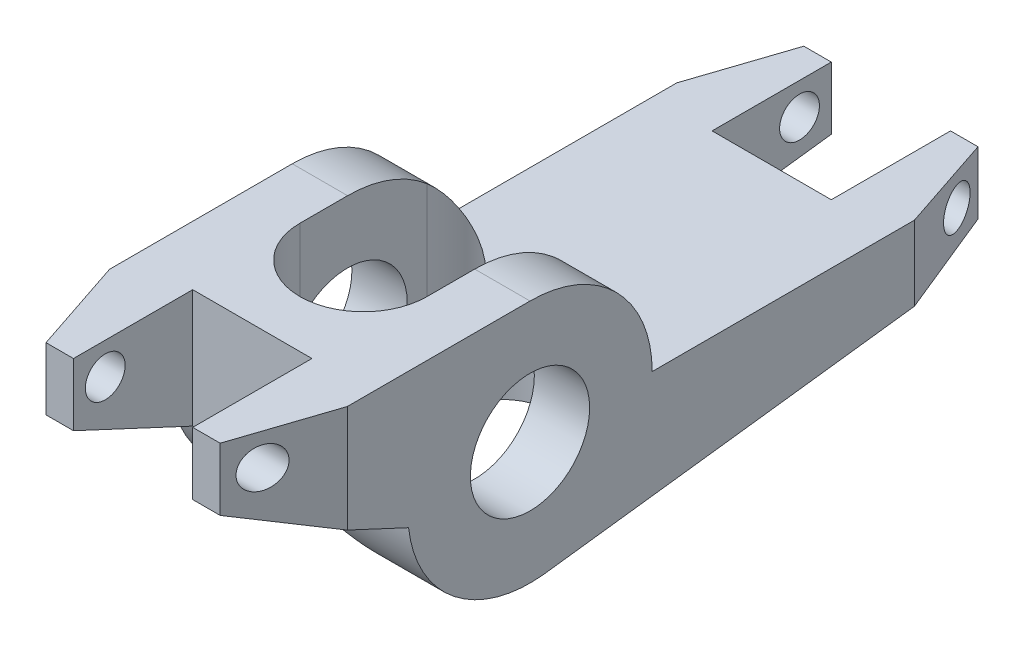
from build123d import *
from OCP.BRepFilletAPI import BRepFilletAPI_MakeChamfer

# Parameters (mm, degrees)
SKETCH2_R               = 4.765
BOSS_EXTRUDE1_DEPTH     = 9.5
CHAMFER1_SIZE           = 2.54
CHAMFER1_SIZE2          = 7.62
CHAMFER2_SIZE           = 7.62
CHAMFER2_SIZE2          = 2.54
CUT_EXTRUDE1_DEPTH      = 41.693294902
CUT_EXTRUDE1_DEPTH_BACK = 41.693294902
CUT_EXTRUDE2_DEPTH      = 41.69329495
CUT_EXTRUDE2_DEPTH_BACK = 41.69329495
SKETCH4_W               = 9.53
SKETCH4_H               = 9.53
CUT_EXTRUDE3_DEPTH      = 41.69329495
CUT_EXTRUDE3_DEPTH_BACK = 41.69329495
SKETCH5_R               = 1.59


with BuildPart() as part:
    # Sketch2 → Boss-Extrude1 (new, symmetric)
    with BuildSketch(Plane(origin=(0, 0, 0), x_dir=(0, 0, -1), z_dir=(1, 0, 0))):
        with BuildLine():
            Line((0, 9.765), (-22.225, 9.765))
            Line((-22.225, 9.765), (-22.225, 4.765))
            Line((-22.225, 4.765), (-9.705896356, -1.072753903))
            ThreePointArc((-9.705896356, -1.072753903), (-6.045130296, -7.668873758), (1.223496761, -9.688048342))
            Line((1.223496761, -9.688048342), (38.345, -5))
            Line((38.345, -5), (38.345, 0))
            Line((38.345, 0), (9.765, 0))
            ThreePointArc((9.765, 0), (6.904897718, 6.904897718), (0, 9.765))
        make_face()
        Circle(SKETCH2_R, mode=Mode.SUBTRACT)
    extrude(amount=BOSS_EXTRUDE1_DEPTH, both=True)

    # Chamfer1: one chamfer whose edges measure the first distance from different faces: ONE call of the kernel's chamfer builder (chamfer() names one face for all edges)
    chamfer1_edges_1 = [part.edges().sort_by_distance(p)[0] for p in [
        (9.5, 7.265, 22.225),
    ]]
    chamfer1_side_1 = [part.faces().sort_by_distance(p)[0] for p in [
        (0, 7.265, 22.225),
    ]]
    chamfer1_edges_2 = [part.edges().sort_by_distance(p)[0] for p in [
        (9.5, -2.5, -38.345),
    ]]
    chamfer1_side_2 = [part.faces().sort_by_distance(p)[0] for p in [
        (0, -2.5, -38.345),
    ]]
    chamfer1 = BRepFilletAPI_MakeChamfer(part.part.solid().wrapped)
    for e in chamfer1_edges_1:
        chamfer1.Add(CHAMFER1_SIZE, CHAMFER1_SIZE2, e.wrapped, chamfer1_side_1[0].wrapped)  # the first distance lies on this face
    for e in chamfer1_edges_2:
        chamfer1.Add(CHAMFER1_SIZE, CHAMFER1_SIZE2, e.wrapped, chamfer1_side_2[0].wrapped)  # the first distance lies on this face
    add(Compound.cast(chamfer1.Shape()), mode=Mode.REPLACE)

    # Chamfer2
    chamfer2_edges = [part.edges().sort_by_distance(p)[0] for p in [
        (-9.5, -2.5, -38.345),
        (-9.5, 7.265, 22.225),
    ]]
    chamfer2_side = [part.faces().sort_by_distance(p)[0] for p in [
        (-9.5, -0.130280991, -5.201405079),
    ]]
    chamfer(chamfer2_edges, length=CHAMFER2_SIZE, length2=CHAMFER2_SIZE2, reference=chamfer2_side[0])

    # Sketch3 → Cut-Extrude1 (cut, two sides: drawn at the far end of the back side and taken through both)
    with BuildSketch(Plane(origin=(0, 0, 0), x_dir=(1, 0, 0), z_dir=(0, 1, 0)).offset(-CUT_EXTRUDE1_DEPTH_BACK)):
        with BuildLine():
            Line((-5.08, -3.81), (-5.08, 6.35))
            ThreePointArc((-5.08, 6.35), (0, 11.43), (5.08, 6.35))
            Line((5.08, 6.35), (5.08, -3.81))
            ThreePointArc((5.08, -3.81), (0, -8.89), (-5.08, -3.81))
        make_face()
    extrude(amount=CUT_EXTRUDE1_DEPTH + CUT_EXTRUDE1_DEPTH_BACK, mode=Mode.SUBTRACT)

    # Sketch4 → Cut-Extrude2 (cut, two sides: drawn at the far end of the back side and taken through both)
    with BuildSketch(Plane(origin=(0, 0, 0), x_dir=(1, 0, 0), z_dir=(0, 1, 0)).offset(-CUT_EXTRUDE2_DEPTH_BACK)):
        with Locations((0, 33.58)):
            Rectangle(SKETCH4_W, SKETCH4_H)
        with Locations((0, -17.46)):
            Rectangle(SKETCH4_W, SKETCH4_H)
    extrude(amount=CUT_EXTRUDE2_DEPTH + CUT_EXTRUDE2_DEPTH_BACK, mode=Mode.SUBTRACT)

    # Sketch5 → Cut-Extrude3 (cut, two sides: drawn at the far end of the back side and taken through both)
    with BuildSketch(Plane(origin=(0, 0, 0), x_dir=(0, 0, -1), z_dir=(1, 0, 0)).offset(-CUT_EXTRUDE3_DEPTH_BACK)):
        with Locations((35.805, -2.54)):
            Circle(SKETCH5_R)
        with Locations(Location((-19.685, 7.225, 0), (0, 0, 180))):
            Circle(SKETCH5_R)
    extrude(amount=CUT_EXTRUDE3_DEPTH + CUT_EXTRUDE3_DEPTH_BACK, mode=Mode.SUBTRACT)


solid = part.part
